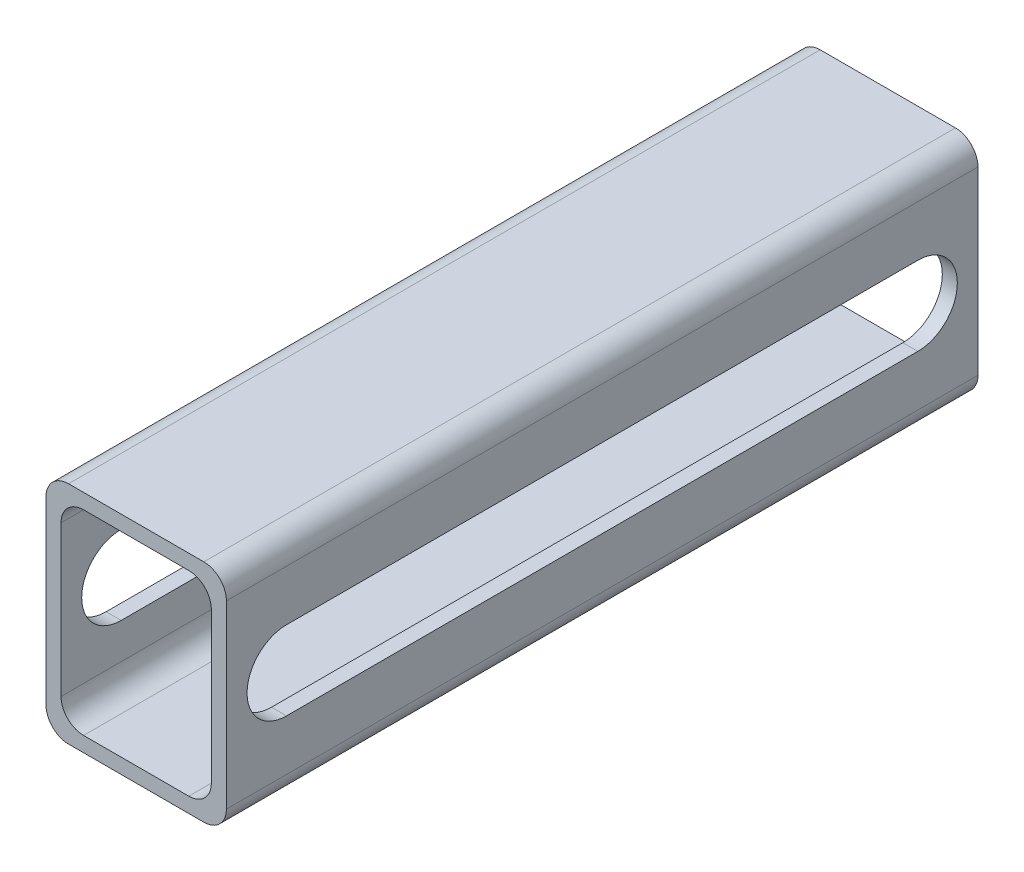
from build123d import *

# Parameters (mm, degrees)
BOSS_EXTRU_1_DEPTH      = 100
ENL_V_MAT_EXTRU_1_DEPTH = 36


with BuildPart() as part:
    # Esquisse1 → Boss.-Extru.1 (new body)
    with BuildSketch(Plane.XY):
        with BuildLine():
            Line((-9, -15), (9, -15))
            ThreePointArc((9, -15), (11.121320344, -14.121320344), (12, -12))
            Line((12, -12), (12, 12))
            ThreePointArc((12, 12), (11.121320344, 14.121320344), (9, 15))
            Line((9, 15), (-9, 15))
            ThreePointArc((-9, 15), (-11.121320344, 14.121320344), (-12, 12))
            Line((-12, 12), (-12, -12))
            ThreePointArc((-12, -12), (-11.121320344, -14.121320344), (-9, -15))
        make_face()
        with BuildLine():
            Line((-7, -13), (7, -13))
            ThreePointArc((7, -13), (9.121320344, -12.121320344), (10, -10))
            Line((10, -10), (10, 10))
            ThreePointArc((10, 10), (9.121320344, 12.121320344), (7, 13))
            Line((7, 13), (-7, 13))
            ThreePointArc((-7, 13), (-9.121320344, 12.121320344), (-10, 10))
            Line((-10, 10), (-10, -10))
            ThreePointArc((-10, -10), (-9.121320344, -12.121320344), (-7, -13))
        make_face(mode=Mode.SUBTRACT)
    extrude(amount=-BOSS_EXTRU_1_DEPTH)

    # Esquisse2 → Enlèv. mat.-Extru.1 (cut)
    with BuildSketch(Plane(origin=(12, 0, 0), x_dir=(0, 0, -1), z_dir=(1, 0, 0))):
        with BuildLine():
            Line((92, -5.25), (8, -5.25))
            ThreePointArc((8, -5.25), (2.75, 0), (8, 5.25))
            Line((8, 5.25), (92, 5.25))
            ThreePointArc((92, 5.25), (97.25, 0), (92, -5.25))
        make_face()
    extrude(amount=-ENL_V_MAT_EXTRU_1_DEPTH, mode=Mode.SUBTRACT)


solid = part.part
